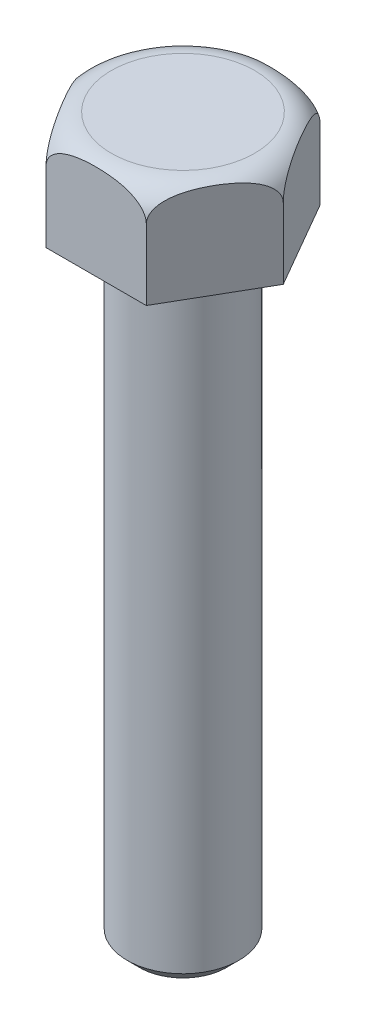
from build123d import *

# Parameters (mm, degrees)
BOSS_EXTRUDE1_DEPTH = 4
SKETCH2_R           = 2.25
BOSS_EXTRUDE2_DEPTH = 25
CHAMFER1_SIZE       = 0.5


with BuildPart() as part:
    # Sketch1 → Boss-Extrude1 (new body)
    with BuildSketch(Plane(origin=(0, 0, 0), x_dir=(1, 0, 0), z_dir=(0, 1, 0))):
        Polygon((4.041451884, 0), (2.020725942, 3.5), (-2.020725942, 3.5), (-4.041451884, 0), (-2.020725942, -3.5), (2.020725942, -3.5), align=None)
    extrude(amount=BOSS_EXTRUDE1_DEPTH)

    # Sketch2 → Boss-Extrude2 (add)
    with BuildSketch(Plane.XZ):
        with Locations(Location((0, 0, 0), (0, 0, 270))):
            Circle(SKETCH2_R)
    extrude(amount=BOSS_EXTRUDE2_DEPTH)

    # Chamfer1
    chamfer1_edges = [part.edges().sort_by_distance(p)[0] for p in [
        (0, -25, 2.25),
    ]]
    chamfer(chamfer1_edges, length=CHAMFER1_SIZE)

    # Sketch3 → Cut-Revolve1 (revolve, cut)
    with BuildSketch(Plane.XY, mode=Mode.PRIVATE) as cut_revolve1_sk:
        with BuildLine():
            Line((2.891451884, 4), (4.041451884, 4))
            Line((4.041451884, 4), (4.041451884, 2.85))
            ThreePointArc((4.041451884, 2.85), (3.704624683, 3.663172798), (2.891451884, 4))
        make_face()
    revolve(cut_revolve1_sk.sketch.rotate(Axis((0, 0, 0), (0, 1, 0)), 90), axis=Axis((0, 0, 0), (0, 1, 0)), mode=Mode.SUBTRACT)


solid = part.part
